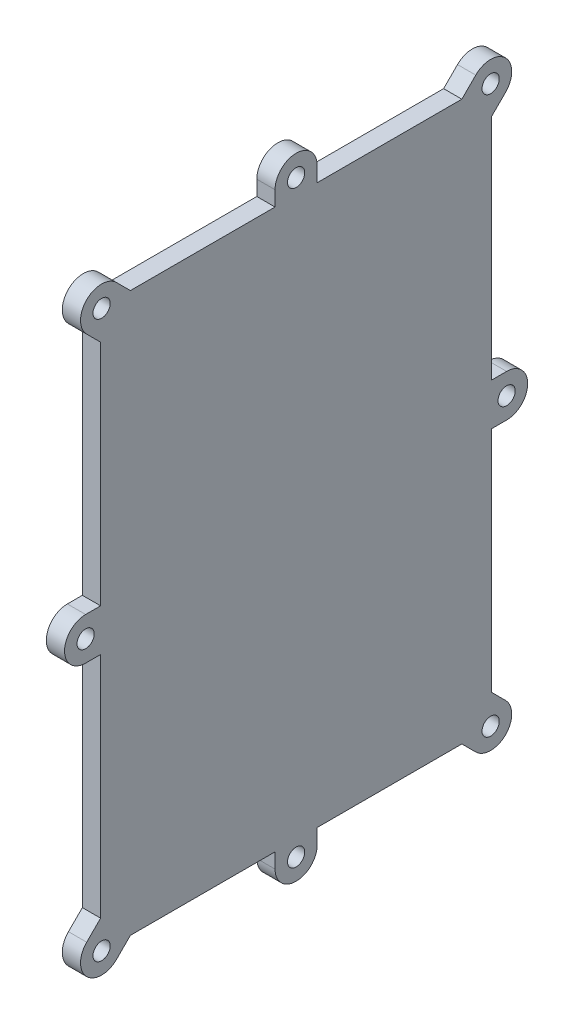
from build123d import *

# Parameters (mm, degrees)
BOSS_EXTRUDE1_DEPTH  = 4.7625
M4_CLEARANCE_HOLE1_D = 4.5


with BuildPart() as part:
    # Sketch1 → Boss-Extrude1 (new body)
    with BuildSketch(Plane(origin=(0, 0, 0), x_dir=(0, 0, -1), z_dir=(1, 0, 0))):
        with BuildLine():
            Line((-12.938571051, 72.8815), (-50.697896458, 72.8815))
            Line((-50.697896458, 72.8815), (-50.697896458, 76.7912))
            ThreePointArc((-50.697896458, 76.7912), (-56.197896458, 82.2912), (-61.697896458, 76.7912))
            Line((-61.697896458, 76.7912), (-61.697896458, 72.8815))
            Line((-61.697896458, 72.8815), (-99.457221865, 72.8815))
            Line((-99.457221865, 72.8815), (-103.084126021, 76.508404156))
            ThreePointArc((-103.084126021, 76.508404156), (-110.862300614, 76.508404156), (-110.862300614, 68.730229563))
            Line((-110.862300614, 68.730229563), (-107.235396458, 65.103325407))
            Line((-107.235396458, 65.103325407), (-107.235396458, 5.5))
            Line((-107.235396458, 5.5), (-111.145096458, 5.5))
            ThreePointArc((-111.145096458, 5.5), (-116.645096458, 0), (-111.145096458, -5.5))
            Line((-111.145096458, -5.5), (-107.235396458, -5.5))
            Line((-107.235396458, -5.5), (-107.235396458, -65.103325407))
            Line((-107.235396458, -65.103325407), (-110.862300614, -68.730229563))
            ThreePointArc((-110.862300614, -68.730229563), (-110.862300614, -76.508404156), (-103.084126021, -76.508404156))
            Line((-103.084126021, -76.508404156), (-99.457221865, -72.8815))
            Line((-99.457221865, -72.8815), (-61.697896458, -72.8815))
            Line((-61.697896458, -72.8815), (-61.697896458, -76.7912))
            ThreePointArc((-61.697896458, -76.7912), (-56.197896458, -82.2912), (-50.697896458, -76.7912))
            Line((-50.697896458, -76.7912), (-50.697896458, -72.8815))
            Line((-50.697896458, -72.8815), (-12.938571051, -72.8815))
            Line((-12.938571051, -72.8815), (-9.311666896, -76.508404156))
            ThreePointArc((-9.311666896, -76.508404156), (-1.533492302, -76.508404156), (-1.533492302, -68.730229563))
            Line((-1.533492302, -68.730229563), (-5.160396458, -65.103325407))
            Line((-5.160396458, -65.103325407), (-5.160396458, -5.5))
            Line((-5.160396458, -5.5), (-1.250696458, -5.5))
            ThreePointArc((-1.250696458, -5.5), (4.249303542, 0), (-1.250696458, 5.5))
            Line((-1.250696458, 5.5), (-5.160396458, 5.5))
            Line((-5.160396458, 5.5), (-5.160396458, 65.103325407))
            Line((-5.160396458, 65.103325407), (-1.533492302, 68.730229563))
            ThreePointArc((-1.533492302, 68.730229563), (-1.533492302, 76.508404156), (-9.311666896, 76.508404156))
            Line((-9.311666896, 76.508404156), (-12.938571051, 72.8815))
        make_face()
    extrude(amount=-BOSS_EXTRUDE1_DEPTH)

    # M4 Clearance Hole1 (through all)
    with Locations(Plane.ZY.offset(4.7625)):
        with Locations((5.422579599, -72.619316859), (1.250696458, 0), (5.422579599, 72.619316859), (106.973213317, 72.619316859), (111.145096458, 0), (106.973213317, -72.619316859), (56.197896458, -76.7912), (56.197896458, 76.7912)):
            Hole(M4_CLEARANCE_HOLE1_D / 2)


solid = part.part
